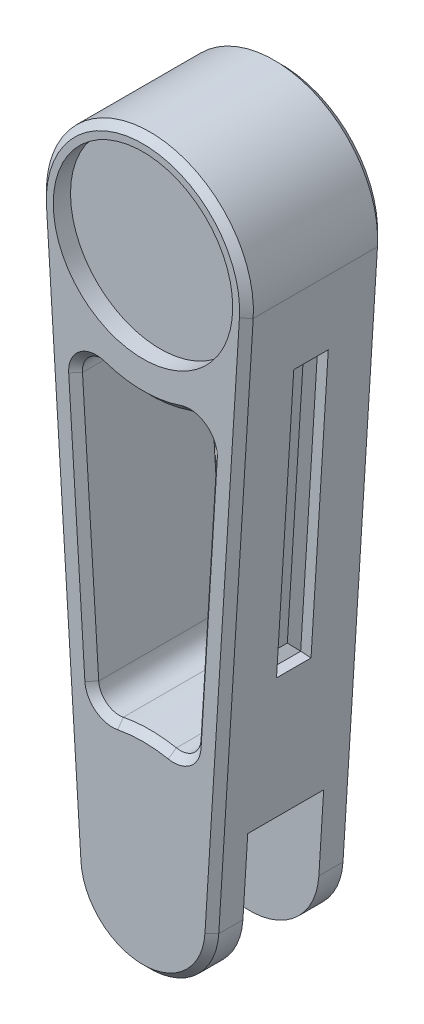
from build123d import *

# Parameters (mm, degrees)
BOSS_EXTRUDE1_DEPTH = 20
SKETCH2_R           = 26
CUT_EXTRUDE1_DEPTH  = 5
SKETCH3_R           = 30
CUT_EXTRUDE2_DEPTH  = 11
CUT_EXTRUDE3_DEPTH  = 187.815416923
FILLET1_R           = 6
CHAMFER1_SIZE       = 2
SKETCH6_W           = 10
SKETCH6_H           = 80
CUT_EXTRUDE4_DEPTH  = 5
CHAMFER2_SIZE       = 2
SKETCH7_R           = 10
SKETCH7_R_2         = 20
CUT_EXTRUDE5_DEPTH  = 5
CHAMFER3_SIZE       = 2


with BuildPart() as part:
    # Sketch1 → Boss-Extrude1 (new, symmetric)
    with BuildSketch(Plane.XY):
        with BuildLine():
            Line((-29.941348918, -1.875), (-19.960899278, -161.25))
            ThreePointArc((-19.960899278, -161.25), (0, -180), (19.960899278, -161.25))
            Line((19.960899278, -161.25), (29.941348918, -1.875))
            ThreePointArc((29.941348918, -1.875), (0, 30), (-29.941348918, -1.875))
        make_face()
    extrude(amount=BOSS_EXTRUDE1_DEPTH, both=True)

    # Sketch2 → Cut-Extrude1 (cut)
    with BuildSketch(Plane(origin=(0, 0, -20), x_dir=(-1, 0, 0), z_dir=(0, 0, -1))):
        Circle(SKETCH2_R)
    extrude(amount=-CUT_EXTRUDE1_DEPTH, mode=Mode.SUBTRACT)

    # Sketch3 → Cut-Extrude2 (cut, symmetric)
    with BuildSketch(Plane.XY):
        with Locations((0, -160)):
            Circle(SKETCH3_R)
    extrude(amount=CUT_EXTRUDE2_DEPTH, both=True, mode=Mode.SUBTRACT)

    # Sketch4 → Cut-Extrude3 (cut, through all)
    with BuildSketch(Plane(origin=(0, 0, -20), x_dir=(-1, 0, 0), z_dir=(0, 0, -1))):
        with BuildLine():
            ThreePointArc((-20.17601335, -29.814903745), (0, -36), (20.17601335, -29.814903745))
            Line((20.17601335, -29.814903745), (14.361387571, -122.667031366))
            ThreePointArc((14.361387571, -122.667031366), (0, -120), (-14.361387571, -122.667031366))
            Line((-14.361387571, -122.667031366), (-20.17601335, -29.814903745))
        make_face()
    extrude(amount=-CUT_EXTRUDE3_DEPTH, mode=Mode.SUBTRACT)

    # Fillet1
    fillet1_edges = [part.edges().sort_by_distance(p)[0] for p in [
        (20.17601335, -29.814903745, 0),
        (-20.17601335, -29.814903745, 0),
        (-14.361387571, -122.667031366, 0),
        (14.361387571, -122.667031366, 0),
    ]]
    fillet(fillet1_edges, radius=FILLET1_R)

    # Chamfer1
    chamfer1_edges = [part.edges().sort_by_distance(p)[0] for p in [
        (0, -180, 20),
        (24.951124098, -81.5625, 20),
        (0, 30, 20),
        (24.951124098, -81.5625, -20),
        (0, -120, -20),
        (0, -120, 20),
        (17.178453178, -77.682101085, -20),
        (0, -180, -20),
        (17.178453178, -77.682101085, 20),
        (-17.178453178, -77.682101085, -20),
        (-17.178453178, -77.682101085, 20),
        (-24.951124098, -81.5625, -20),
        (0, -36, -20),
        (0, -36, 20),
        (12.505327982, -119.60645162, -20),
        (12.505327982, -119.60645162, 20),
        (-12.505327982, -119.60645162, -20),
        (-12.505327982, -119.60645162, 20),
        (17.184830058, -34.989739942, -20),
        (0, 30, -20),
        (17.184830058, -34.989739942, 20),
        (-17.184830058, -34.989739942, -20),
        (-17.184830058, -34.989739942, 20),
        (-24.951124098, -81.5625, 20),
    ]]
    chamfer(chamfer1_edges, length=CHAMFER1_SIZE)

    # Sketch6 → Cut-Extrude4 (cut)
    with BuildSketch(Plane(origin=(29.941348918, -1.875, 0), x_dir=(0, 0, -1), z_dir=(0.9980449639169571, -0.06249999999999982, 0))):
        with Locations((0, -60)):
            Rectangle(SKETCH6_W, SKETCH6_H)
    extrude(amount=-CUT_EXTRUDE4_DEPTH, mode=Mode.SUBTRACT)

    # Chamfer2
    chamfer2_edges = [part.edges().sort_by_distance(p)[0] for p in [
        (21.201124098, -61.445197835, 5),
        (23.701124098, -21.523399278, 0),
        (21.201124098, -61.445197835, -5),
        (18.701124098, -101.366996392, 0),
    ]]
    chamfer(chamfer2_edges, length=CHAMFER2_SIZE)

    # Sketch7 → Cut-Extrude5 (cut)
    with BuildSketch(Plane.XY.offset(20)):
        with Locations((0, -160)):
            Circle(SKETCH7_R)
        Circle(SKETCH7_R_2)
    extrude(amount=-CUT_EXTRUDE5_DEPTH, mode=Mode.SUBTRACT)

    # Chamfer3
    chamfer3_edges = [part.edges().sort_by_distance(p)[0] for p in [
        (-10, -160, 15),
        (-10, -160, 20),
        (-20, 0, 15),
        (-20, 0, 20),
    ]]
    chamfer(chamfer3_edges, length=CHAMFER3_SIZE)


with BuildPart() as body_2:
    # Mirror1: mirrored copy
    add(part.part.mirror(Plane.XY))


solid = body_2.part
